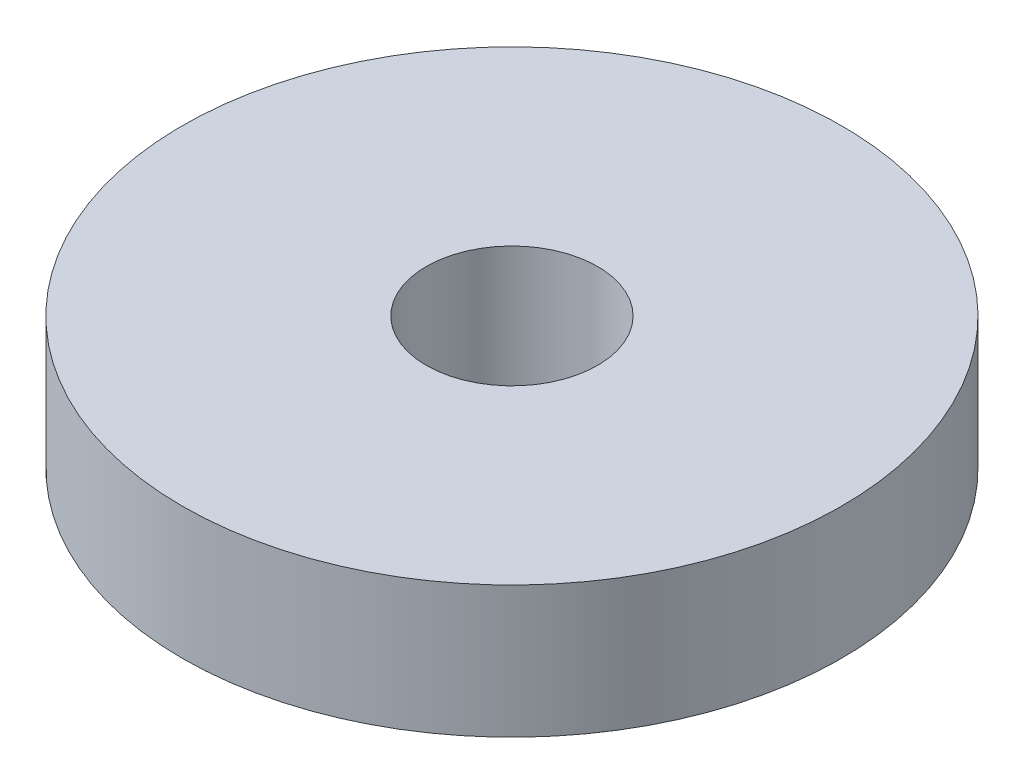
from build123d import *

# Parameters (mm, degrees)
SKETCH1_R           = 6.35
SKETCH1_R_2         = 1.651
BOSS_EXTRUDE1_DEPTH = 2.54


with BuildPart() as part:
    # Sketch1 → Boss-Extrude1 (new body)
    with BuildSketch(Plane(origin=(0, 0, 0), x_dir=(1, 0, 0), z_dir=(0, 1, 0))):
        with Locations(Location((0, 0, 0), (0, 0, 270))):
            Circle(SKETCH1_R)
        with Locations(Location((0, 0, 0), (0, 0, 270))):
            Circle(SKETCH1_R_2, mode=Mode.SUBTRACT)
    extrude(amount=BOSS_EXTRUDE1_DEPTH)


solid = part.part
